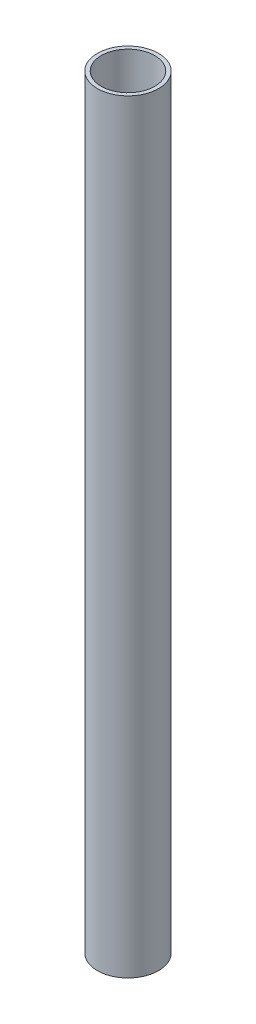
from build123d import *

# Parameters (mm, degrees)
SKETCH_1_R      = 8
SKETCH_1_R_2    = 7
EXTRUDE_1_DEPTH = 200


with BuildPart() as part:
    # 草图1 → 凸台-拉伸1 (new body)
    with BuildSketch(Plane(origin=(0, 0, 0), x_dir=(1, 0, 0), z_dir=(0, 1, 0))):
        with Locations(Location((0, 0, 0), (0, 0, 270))):
            Circle(SKETCH_1_R)
        with Locations(Location((0, 0, 0), (0, 0, 270))):
            Circle(SKETCH_1_R_2, mode=Mode.SUBTRACT)
    extrude(amount=EXTRUDE_1_DEPTH)


solid = part.part
